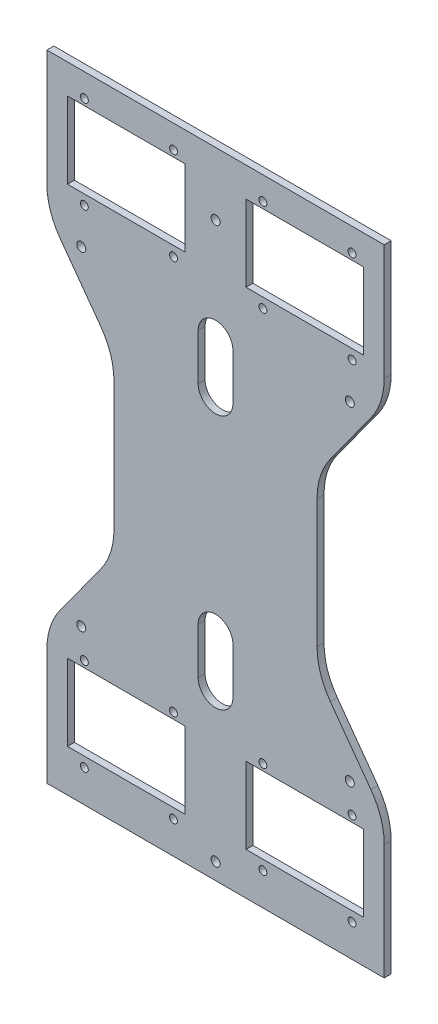
from build123d import *

# Parameters (mm, degrees)
SALIENTE_EXTRUIR1_DEPTH        = 3
REDONDEO1_R                    = 30
CORTAR_EXTRUIR1_DEPTH          = 156.335310697
TALADRO_DE_MARGEN_PARA_M31_D   = 3.4
CROQUIS16_W                    = 50.8
CROQUIS16_H                    = 33
CORTAR_EXTRUIR2_DEPTH          = 156.335310697
TALADRO_DE_MARGEN_PARA_M3_51_D = 3.9


with BuildPart() as part:
    # Croquis1 → Saliente-Extruir1 (new body)
    with BuildSketch(Plane.XY):
        Polygon((72.862780289, -137.153468779), (-72.862780289, -137.153468779), (-72.862780289, -77.415075694), (-43.862780289, -37.5), (-43.862780289, 37.5), (-72.862780289, 77.415075694), (-72.862780289, 137.153468779), (72.862780289, 137.153468779), (72.862780289, 77.415075694), (43.862780289, 37.5), (43.862780289, -37.5), (72.862780289, -77.415075694), align=None)
    extrude(amount=SALIENTE_EXTRUIR1_DEPTH)

    # Redondeo1
    redondeo1_edges = [part.edges().sort_by_distance(p)[0] for p in [
        (72.862780289, 77.415075694, 1.5),
        (43.862780289, 37.5, 1.5),
        (43.862780289, -37.5, 1.5),
        (72.862780289, -77.415075694, 1.5),
        (-72.862780289, -77.415075694, 1.5),
        (-43.862780289, -37.5, 1.5),
        (-43.862780289, 37.5, 1.5),
        (-72.862780289, 77.415075694, 1.5),
    ]]
    fillet(redondeo1_edges, radius=REDONDEO1_R)

    # Croquis2 → Cortar-Extruir1 (cut, through all)
    with BuildSketch(Plane.XY.offset(3)):
        with BuildLine():
            Line((-7.5, 45), (-7.5, 65))
            ThreePointArc((-7.5, 65), (0, 72.5), (7.5, 65))
            Line((7.5, 65), (7.5, 45))
            ThreePointArc((7.5, 45), (0, 37.5), (-7.5, 45))
        make_face()
    cortar_extruir1 = extrude(amount=-CORTAR_EXTRUIR1_DEPTH, mode=Mode.SUBTRACT)

    # Simetría1: Cortar-Extruir1 across plane
    add(cortar_extruir1.mirror(Plane.ZX), mode=Mode.SUBTRACT)

    # Taladro de margen para M31 (through all)
    with Locations(Plane.XY.offset(3)):
        with Locations((-56.662780289, 127.153468779), (-18.162780289, 127.153468779), (-18.162780289, 87.153468779), (-56.662780289, 87.153468779), (20.462780289, 127.153468779), (20.462780289, 87.153468779), (58.962780289, 87.153468779), (58.962780289, 127.153468779), (58.962780289, -123.153468779), (20.462780289, -123.153468779), (20.462780289, -83.153468779), (58.962780289, -83.153468779), (-18.162780289, -123.153468779), (-56.662780289, -123.153468779), (-56.662780289, -83.153468779), (-18.162780289, -83.153468779)):
            Hole(TALADRO_DE_MARGEN_PARA_M31_D / 2)

    # Croquis16 → Cortar-Extruir2 (cut, through all)
    with BuildSketch(Plane(origin=(0, 0, 0), x_dir=(-1, 0, 0), z_dir=(0, 0, -1))):
        with Locations((-38.562780289, 107.903468779)):
            Rectangle(CROQUIS16_W, CROQUIS16_H)
        with Locations((38.562780289, 107.903468779)):
            Rectangle(CROQUIS16_W, CROQUIS16_H)
        with Locations((38.562780289, -102.403468779)):
            Rectangle(CROQUIS16_W, CROQUIS16_H)
        with Locations((-38.562780289, -102.403468779)):
            Rectangle(CROQUIS16_W, CROQUIS16_H)
    extrude(amount=-CORTAR_EXTRUIR2_DEPTH, mode=Mode.SUBTRACT)

    # Taladro de margen para M3.51 (through all)
    with Locations(Plane.XY.offset(3)):
        with Locations((-58, 71), (0, 110), (-58, -71), (0, -130), (58, -71), (58, 71)):
            Hole(TALADRO_DE_MARGEN_PARA_M3_51_D / 2)


solid = part.part
